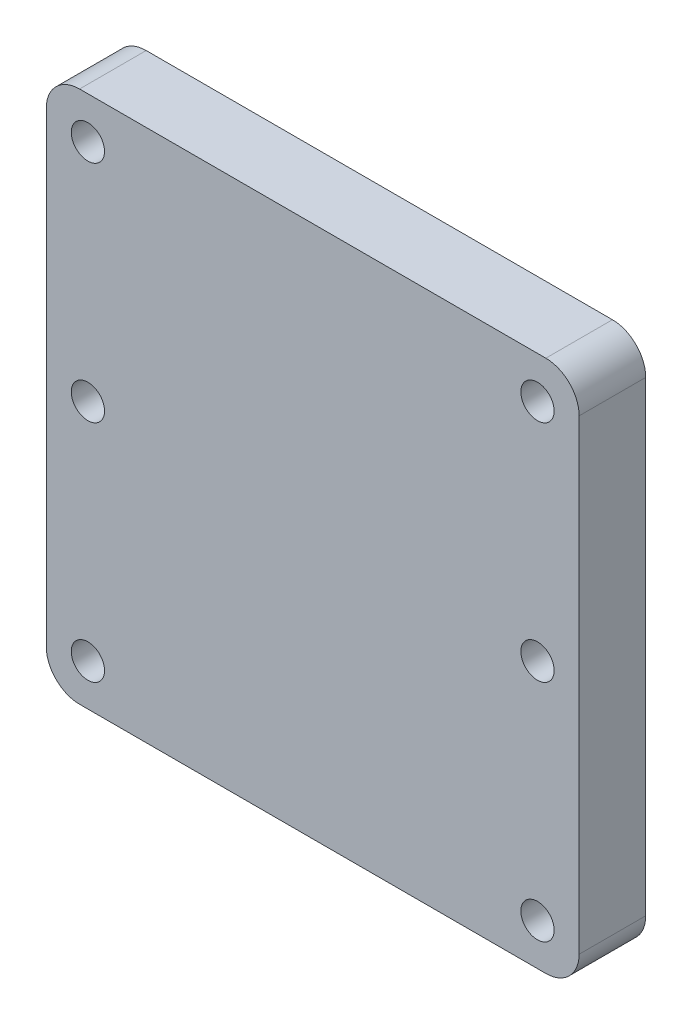
from build123d import *

# Parameters (mm, degrees)
BOTTOM_PLATE_SKETCH_PROFILE_R = 3.175
BOTTOM_PLATE_EXTRUDE_DEPTH    = 12.7


with BuildPart() as part:
    # Bottom Plate Sketch Profile → Bottom Plate Extrude (new body)
    with BuildSketch(Plane.XY):
        with BuildLine():
            Line((44.45, -50.8), (-44.45, -50.8))
            ThreePointArc((-44.45, -50.8), (-48.940128061, -48.940128061), (-50.8, -44.45))
            Line((-50.8, -44.45), (-50.8, 44.45))
            ThreePointArc((-50.8, 44.45), (-48.940128061, 48.940128061), (-44.45, 50.8))
            Line((-44.45, 50.8), (44.45, 50.8))
            ThreePointArc((44.45, 50.8), (48.940128061, 48.940128061), (50.8, 44.45))
            Line((50.8, 44.45), (50.8, -44.45))
            ThreePointArc((50.8, -44.45), (48.940128061, -48.940128061), (44.45, -50.8))
        make_face()
        with Locations((-42.8625, 42.8625)):
            Circle(BOTTOM_PLATE_SKETCH_PROFILE_R, mode=Mode.SUBTRACT)
        with Locations((42.8625, 42.8625)):
            Circle(BOTTOM_PLATE_SKETCH_PROFILE_R, mode=Mode.SUBTRACT)
        with Locations((42.8625, -42.8625)):
            Circle(BOTTOM_PLATE_SKETCH_PROFILE_R, mode=Mode.SUBTRACT)
        with Locations((-42.8625, -42.8625)):
            Circle(BOTTOM_PLATE_SKETCH_PROFILE_R, mode=Mode.SUBTRACT)
        with Locations((-42.8625, 0)):
            Circle(BOTTOM_PLATE_SKETCH_PROFILE_R, mode=Mode.SUBTRACT)
        with Locations((42.8625, 0)):
            Circle(BOTTOM_PLATE_SKETCH_PROFILE_R, mode=Mode.SUBTRACT)
    extrude(amount=BOTTOM_PLATE_EXTRUDE_DEPTH)


solid = part.part
